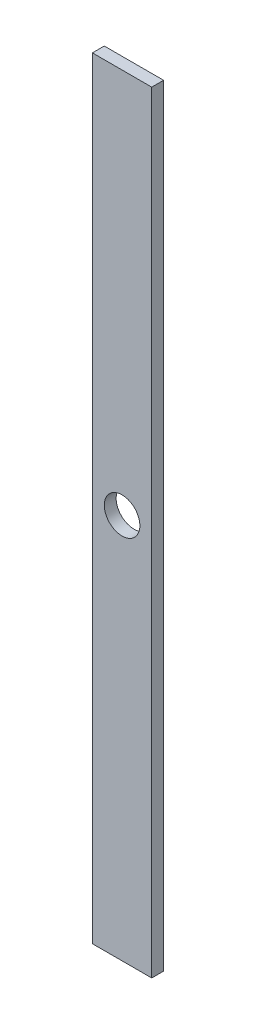
from build123d import *

# Parameters (mm, degrees)
ESQUISSE1_W        = 50
ESQUISSE1_H        = 650
ESQUISSE1_R        = 15
BOSS_EXTRU_1_DEPTH = 10


with BuildPart() as part:
    # Esquisse1 → Boss.-Extru.1 (new body)
    with BuildSketch(Plane.XY):
        with Locations((25, -325)):
            Rectangle(ESQUISSE1_W, ESQUISSE1_H)
        with Locations((25, -325)):
            Circle(ESQUISSE1_R, mode=Mode.SUBTRACT)
    extrude(amount=BOSS_EXTRU_1_DEPTH)


solid = part.part
